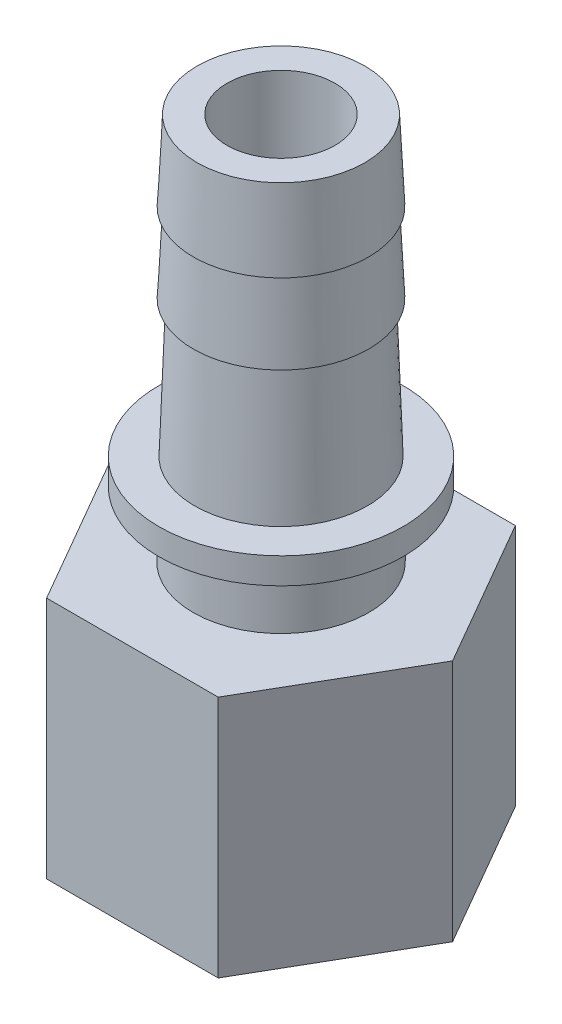
from build123d import *

# Parameters (mm, degrees)
BOSS_EXTRUDE1_DEPTH     = 28.575
SKETCH2_R               = 10.3251
BOSS_EXTRUDE2_DEPTH     = 7.6962
SKETCH3_R               = 14.351
BOSS_EXTRUDE3_DEPTH     = 3.0607
SKETCH6_R               = 11.7348
CUT_EXTRUDE1_DEPTH      = 19.9771
SKETCH7_R               = 6.3373
CUT_EXTRUDE2_DEPTH      = 72.2884
CUT_EXTRUDE3_DEPTH      = 103.717779464
CUT_EXTRUDE3_DEPTH_BACK = 103.717779464
SKETCH15_W              = 20.5867
SKETCH15_H              = 9.3726
SKETCH15_H_2            = 16.0274


with BuildPart() as part:
    # Sketch1 → Boss-Extrude1 (new body)
    with BuildSketch(Plane(origin=(0, 0, 0), x_dir=(1, 0, 0), z_dir=(0, 1, 0))):
        Polygon((10.078312902, 17.45615), (-10.078312902, 17.45615), (-20.156625803, 0), (-10.078312902, -17.45615), (10.078312902, -17.45615), (20.156625803, 0), align=None)
    extrude(amount=BOSS_EXTRUDE1_DEPTH)

    # Sketch2 → Boss-Extrude2 (add)
    with BuildSketch(Plane(origin=(0, 28.575, 0), x_dir=(1, 0, 0), z_dir=(0, 1, 0))):
        with Locations(Location((0, 0, 0), (0, 0, 270))):
            Circle(SKETCH2_R)
    extrude(amount=BOSS_EXTRUDE2_DEPTH)

    # Sketch3 → Boss-Extrude3 (add)
    with BuildSketch(Plane(origin=(0, 36.2712, 0), x_dir=(1, 0, 0), z_dir=(0, 1, 0))):
        with Locations(Location((0, 0, 0), (0, 0, 270))):
            Circle(SKETCH3_R)
    extrude(amount=BOSS_EXTRUDE3_DEPTH)

    # Sketch4 → Revolve2 (revolve)
    with BuildSketch(Plane.XY, mode=Mode.PRIVATE) as revolve2_sk:
        Polygon((0, 55.3593), (9.6012, 55.3593), (10.1473, 39.3319), (0, 39.3319), align=None)
    revolve(revolve2_sk.sketch.rotate(Axis((0, 55.3593, 0), (0, -1, 0)), 180), axis=Axis((0, 55.3593, 0), (0, -1, 0)))

    # Sketch5 → Revolve3 (revolve)
    with BuildSketch(Plane.XY):
        Polygon((0, 55.3593), (10.29335, 55.3593), (9.84885, 64.7319), (0, 64.7319), align=None)
        Polygon((0, 74.1045), (0, 64.7319), (9.84885, 64.7319), (10.29335, 64.7319), (9.84885, 74.1045), align=None)
        Polygon((0, 83.4771), (0, 74.1045), (9.84885, 74.1045), (10.29335, 74.1045), (9.84885, 83.4771), align=None)
        Polygon((0, 92.8497), (0, 83.4771), (9.84885, 83.4771), (10.29335, 83.4771), (9.84885, 92.8497), align=None)
    revolve(axis=Axis((0, 55.3593, 0), (0, 1, 0)))

    # Sketch6 → Cut-Extrude1 (cut)
    with BuildSketch(Plane(origin=(0, 0, 0), x_dir=(-1, 0, 0), z_dir=(0, -1, 0))):
        with Locations(Location((0, 0, 0), (0, 0, 90))):
            Circle(SKETCH6_R)
    extrude(amount=-CUT_EXTRUDE1_DEPTH, mode=Mode.SUBTRACT)

    # Sketch7 → Cut-Extrude2 (cut)
    with BuildSketch(Plane(origin=(0, 92.8497, 0), x_dir=(1, 0, 0), z_dir=(0, 1, 0))):
        with Locations(Location((0, 0, 0), (0, 0, 180))):
            Circle(SKETCH7_R)
    extrude(amount=-CUT_EXTRUDE2_DEPTH, mode=Mode.SUBTRACT)

    # Sketch14 → Cut-Revolve1 (revolve, cut)
    with BuildSketch(Plane.XY, mode=Mode.PRIVATE) as cut_revolve1_sk:
        Polygon((6.3373, 20.5613), (0, 20.5613), (0, 19.9771), (11.7348, 19.9771), align=None)
    revolve(cut_revolve1_sk.sketch.rotate(Axis((0, 20.5613, 0), (0, -1, 0)), 180), axis=Axis((0, 20.5613, 0), (0, -1, 0)), mode=Mode.SUBTRACT)

    # Sketch15 → Cut-Extrude3 (cut, two sides: drawn at the far end of the back side and taken through both)
    with BuildSketch(Plane(origin=(15.117469352, 0, -8.728075), x_dir=(-0.4999999999999997, 0, -0.8660254037844388), z_dir=(0.8660254037844389, 0, -0.49999999999999983)).offset(-CUT_EXTRUDE3_DEPTH_BACK)):
        with Locations((0, 78.7908)):
            Rectangle(SKETCH15_W, SKETCH15_H)
        with Locations((0, 91.4908)):
            Rectangle(SKETCH15_W, SKETCH15_H_2)
    extrude(amount=CUT_EXTRUDE3_DEPTH + CUT_EXTRUDE3_DEPTH_BACK, mode=Mode.SUBTRACT)


solid = part.part
